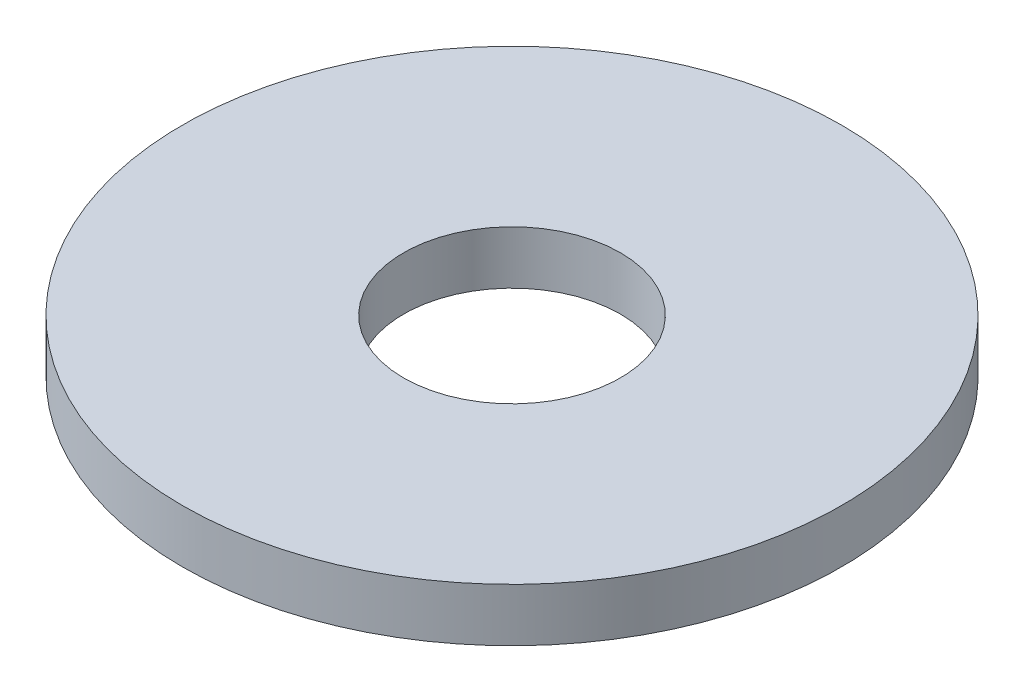
from build123d import *

# Parameters (mm, degrees)
SKETCH1_R                         = 31
SKETCH1_R_2                       = 10.2
REVOLVED_EQUIVALENT_EXTRUDE_DEPTH = 5


with BuildPart() as part:
    # Sketch1 → Revolved_Equivalent_Extrude (new body)
    with BuildSketch(Plane(origin=(0, 0, 0), x_dir=(1, 0, 0), z_dir=(0, 1, 0))):
        with Locations(Location((0, 0, 0), (0, 0, 270))):
            Circle(SKETCH1_R)
        with Locations(Location((0, 0, 0), (0, 0, 270))):
            Circle(SKETCH1_R_2, mode=Mode.SUBTRACT)
    extrude(amount=REVOLVED_EQUIVALENT_EXTRUDE_DEPTH)


solid = part.part
